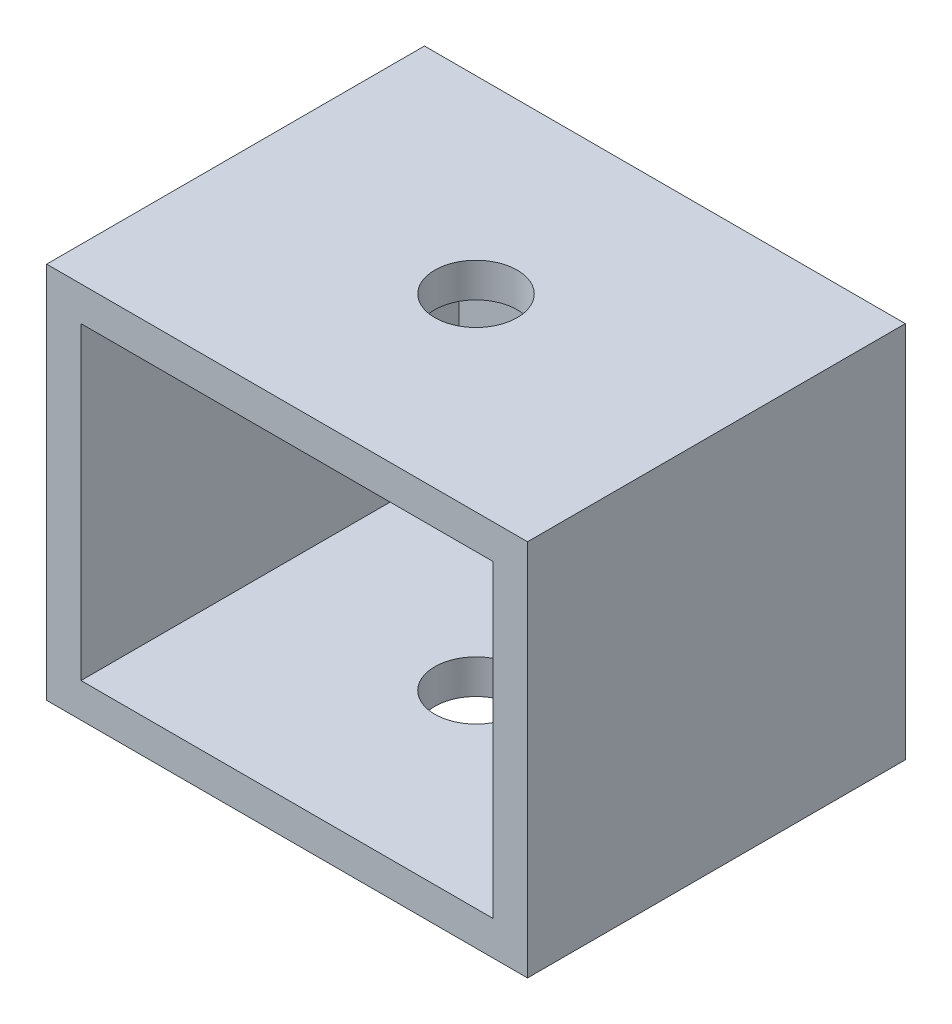
from build123d import *

# Parameters (mm, degrees)
SKETCH1_W           = 70
SKETCH1_H           = 55
BOSS_EXTRUDE1_DEPTH = 5
SKETCH2_W           = 5
SKETCH2_H           = 45
SKETCH2_W_2         = 5.019591865
CUT_EXTRUDE1_DEPTH  = 5
SKETCH6_W           = 60
SKETCH6_H           = 45
BOSS_EXTRUDE4_DEPTH = 50
SKETCH7_R           = 6
CUT_EXTRUDE2_DEPTH  = 70
SKETCH8_W           = 5
SKETCH8_H           = 10
BOSS_EXTRUDE5_DEPTH = 5
SKETCH9_W           = 5
SKETCH9_H           = 10
BOSS_EXTRUDE6_DEPTH = 5


with BuildPart() as part:
    # Sketch1 → Boss-Extrude1 (new body)
    with BuildSketch(Plane.XY):
        with Locations((-35, 27.5)):
            Rectangle(SKETCH1_W, SKETCH1_H)
    extrude(amount=BOSS_EXTRUDE1_DEPTH)

    # Sketch2 → Cut-Extrude1 (cut)
    with BuildSketch(Plane.XY.offset(5)):
        with Locations((-62.5, 27.5)):
            Rectangle(SKETCH2_W, SKETCH2_H)
        with Locations((-7.509795933, 27.5)):
            Rectangle(SKETCH2_W_2, SKETCH2_H)
    extrude(amount=-CUT_EXTRUDE1_DEPTH, mode=Mode.SUBTRACT)

    # Sketch6 → Boss-Extrude4 (add)
    with BuildSketch(Plane.XY.offset(5)):
        Polygon((-70, 0), (-65, 0), (-5, 0), (0, 0), (0, 55), (-5, 55), (-65, 55), (-70, 55), align=None)
        with Locations((-35, 27.5)):
            Rectangle(SKETCH6_W, SKETCH6_H, mode=Mode.SUBTRACT)
    extrude(amount=BOSS_EXTRUDE4_DEPTH)

    # Sketch7 → Cut-Extrude2 (cut)
    with BuildSketch(Plane(origin=(0, 55, 0), x_dir=(1, 0, 0), z_dir=(0, 1, 0))):
        with Locations(Location((-35, -27.5, 0), (0, 0, 90))):
            Circle(SKETCH7_R)
    extrude(amount=-CUT_EXTRUDE2_DEPTH, mode=Mode.SUBTRACT)

    # Sketch8 → Boss-Extrude5 (add)
    with BuildSketch(Plane(origin=(-10.019591865, 0, 0), x_dir=(0, 0, -1), z_dir=(1, 0, 0))):
        with Locations((-2.5, 45)):
            Rectangle(SKETCH8_W, SKETCH8_H)
    extrude(amount=BOSS_EXTRUDE5_DEPTH)

    # Sketch9 → Boss-Extrude6 (add)
    with BuildSketch(Plane.ZY.offset(60)):
        with Locations((2.5, 45)):
            Rectangle(SKETCH9_W, SKETCH9_H)
    extrude(amount=BOSS_EXTRUDE6_DEPTH)


solid = part.part
